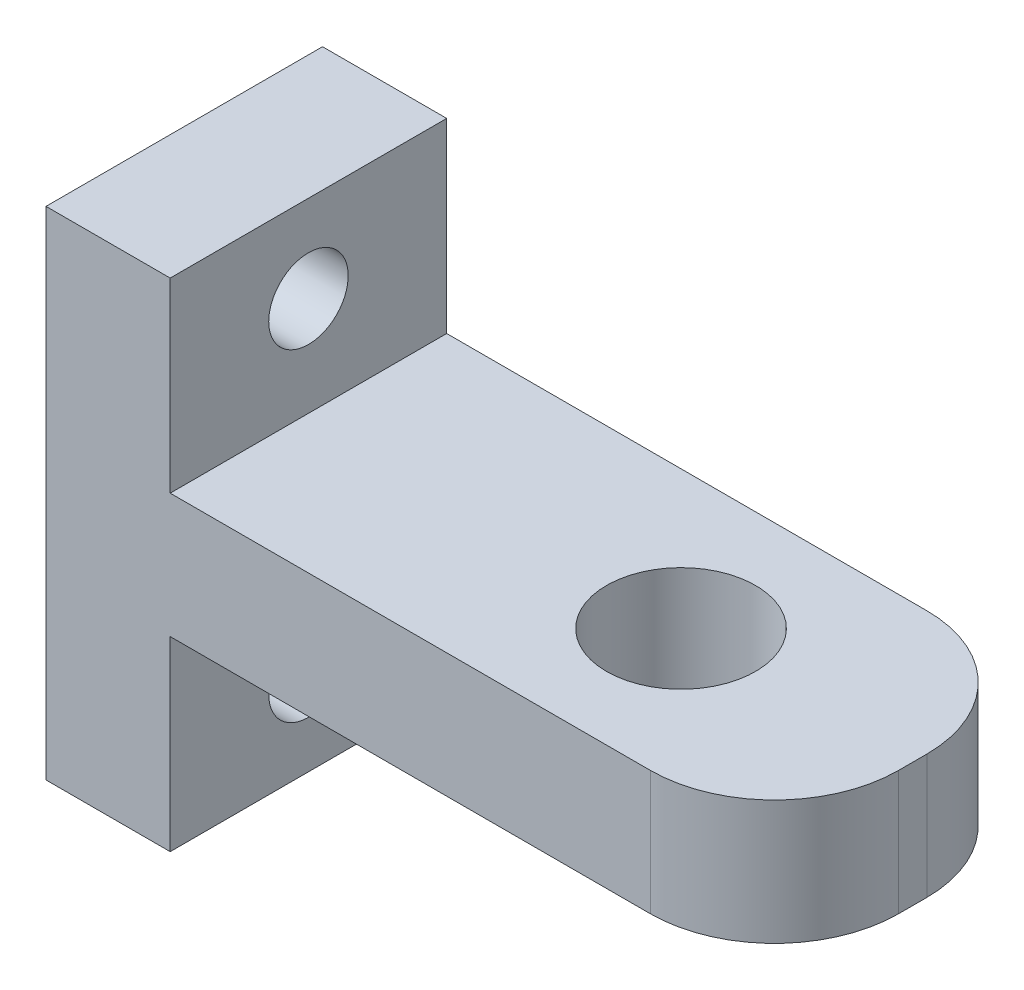
from build123d import *

# Parameters (mm, degrees)
SKETCH1_W           = 30
SKETCH1_H           = 20
BOSS_EXTRUDE1_DEPTH = 5
SKETCH2_R           = 3
CUT_EXTRUDE1_DEPTH  = 10
SKETCH3_OUTSIDE_W   = 39.28
SKETCH3_OUTSIDE_H   = 29.28
SKETCH3_OUTSIDE_W_2 = 24.327904035
SKETCH3_OUTSIDE_H_2 = 11.132815548
CUT_EXTRUDE2_DEPTH  = 10
SKETCH4_W           = 11.132815548
SKETCH4_H           = 20
BOSS_EXTRUDE2_DEPTH = 5
SKETCH5_R           = 1.6
CUT_EXTRUDE3_DEPTH  = 5
FILLET2_R           = 5


with BuildPart() as part:
    # Sketch1 → Boss-Extrude1 (new body)
    with BuildSketch(Plane(origin=(0, 0, 0), x_dir=(1, 0, 0), z_dir=(0, 1, 0))):
        Rectangle(SKETCH1_W, SKETCH1_H)
    extrude(amount=BOSS_EXTRUDE1_DEPTH)

    # Sketch2 → Cut-Extrude1 (cut)
    with BuildSketch(Plane(origin=(0, 5, 0), x_dir=(1, 0, 0), z_dir=(0, 1, 0))):
        with Locations(Location((0, 0, 0), (0, 0, 270))):
            Circle(SKETCH2_R)
    extrude(amount=-CUT_EXTRUDE1_DEPTH, mode=Mode.SUBTRACT)

    # Sketch3 outside → Cut-Extrude2 (cut)
    with BuildSketch(Plane(origin=(0, 5, 0), x_dir=(1, 0, 0), z_dir=(0, 1, 0))):
        Rectangle(SKETCH3_OUTSIDE_W, SKETCH3_OUTSIDE_H)
        with Locations((-2.836047983, 0)):
            Rectangle(SKETCH3_OUTSIDE_W_2, SKETCH3_OUTSIDE_H_2, mode=Mode.SUBTRACT)
    extrude(amount=-CUT_EXTRUDE2_DEPTH, mode=Mode.SUBTRACT)

    # Sketch4 → Boss-Extrude2 (add)
    with BuildSketch(Plane.ZY.offset(15)):
        with Locations((0, 2.5)):
            Rectangle(SKETCH4_W, SKETCH4_H)
    extrude(amount=BOSS_EXTRUDE2_DEPTH)

    # Sketch5 → Cut-Extrude3 (cut)
    with BuildSketch(Plane.ZY.offset(20)):
        with Locations((0, 9)):
            Circle(SKETCH5_R)
        with Locations(Location((0, -4, 0), (0, 0, 180))):
            Circle(SKETCH5_R)
    extrude(amount=-CUT_EXTRUDE3_DEPTH, mode=Mode.SUBTRACT)

    # Fillet2
    fillet2_edges = [part.edges().sort_by_distance(p)[0] for p in [
        (9.327904035, 2.5, -5.566407774),
        (9.327904035, 2.5, 5.566407774),
    ]]
    fillet(fillet2_edges, radius=FILLET2_R)


solid = part.part
